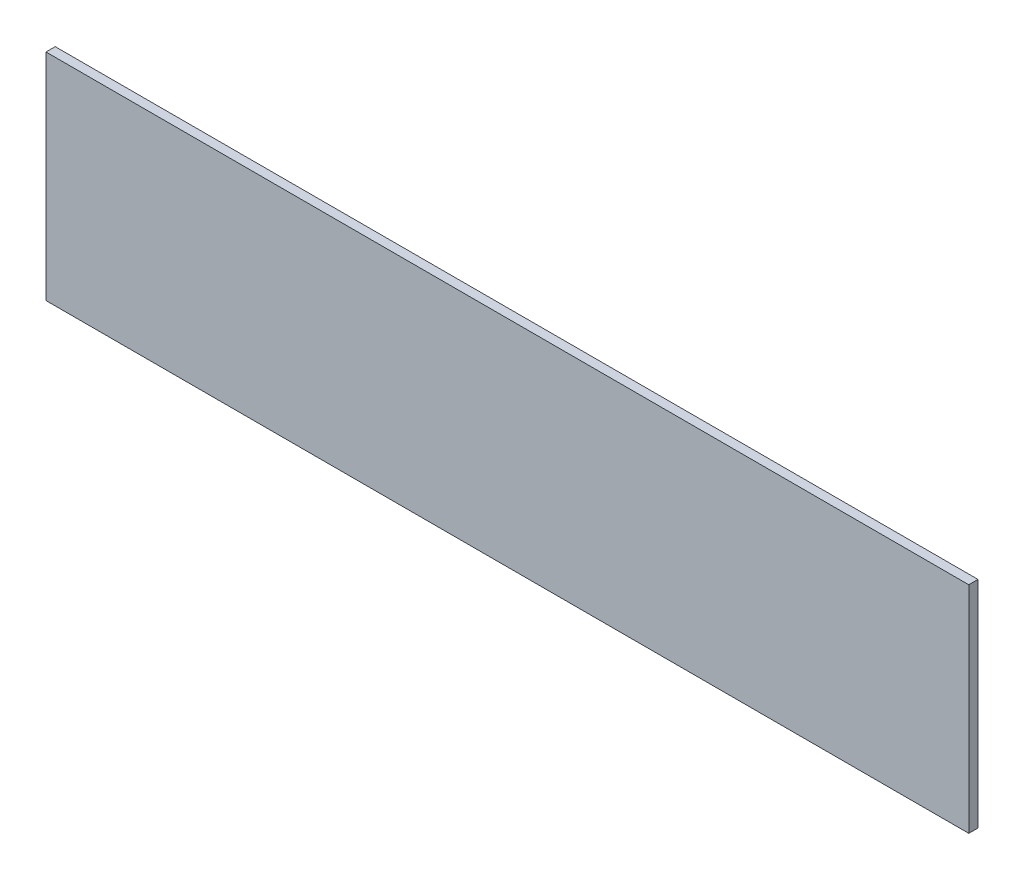
from build123d import *

# Parameters (mm, degrees)
SKETCH_2_W      = 300
SKETCH_2_H      = 70
EXTRUDE_1_DEPTH = 3


with BuildPart() as part:
    # Эскиз2 → Бобышка-Вытянуть1 (new body)
    with BuildSketch(Plane.XY.offset(-10)):
        Rectangle(SKETCH_2_W, SKETCH_2_H)
    extrude(amount=EXTRUDE_1_DEPTH)


solid = part.part
